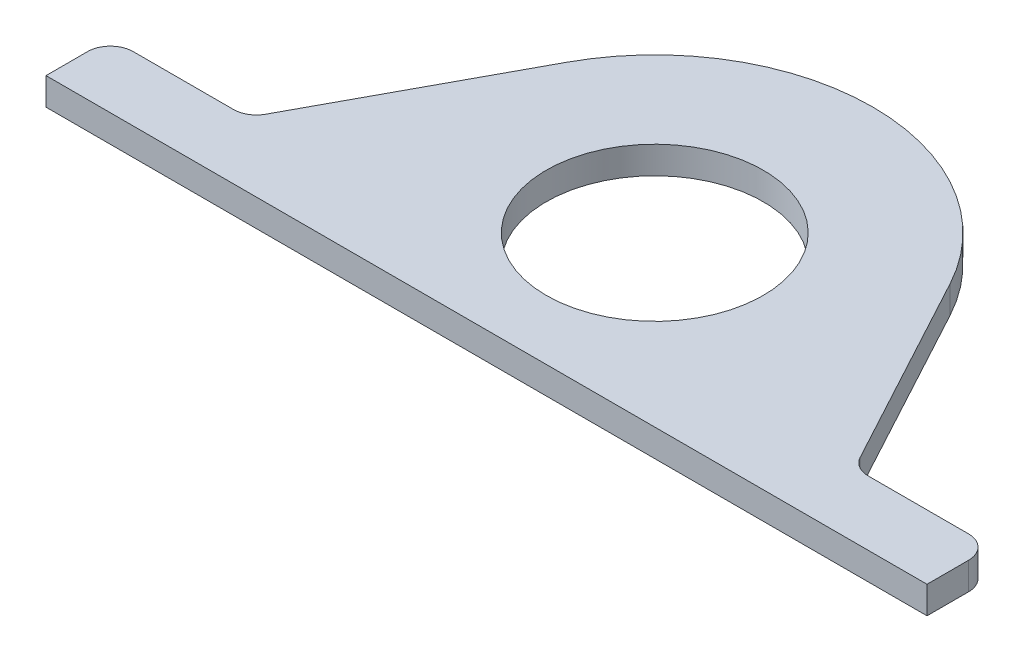
from build123d import *

# Parameters (mm, degrees)
SKETCH1_R           = 23.8
BOSS_EXTRUDE1_DEPTH = 6
SKETCH2_W           = 239.918851676
SKETCH2_H           = 8.691365156
CUT_EXTRUDE1_DEPTH  = 10


with BuildPart() as part:
    # Sketch1 → Boss-Extrude1 (new body)
    with BuildSketch(Plane(origin=(0, 0, 0), x_dir=(1, 0, 0), z_dir=(0, 1, 0))):
        with BuildLine():
            Line((65, -39.8), (-65, -39.8))
            Line((-65, -39.8), (-96.605676951, -39.8))
            Line((-96.605676951, -39.8), (-96.605676951, -27.775552827))
            ThreePointArc((-96.605676951, -27.775552827), (-95.141210857, -24.240018922), (-91.605676951, -22.775552827))
            Line((-91.605676951, -22.775552827), (-69.589095412, -22.775552827))
            ThreePointArc((-69.589095412, -22.775552827), (-67.027094411, -22.069286735), (-65.188875184, -20.150013174))
            Line((-65.188875184, -20.150013174), (-42.066105387, 22.699840916))
            ThreePointArc((-42.066105387, 22.699840916), (0, 47.8), (42.066105387, 22.699840916))
            Line((42.066105387, 22.699840916), (65.188875184, -20.150013174))
            ThreePointArc((65.188875184, -20.150013174), (67.027094411, -22.069286735), (69.589095412, -22.775552827))
            Line((69.589095412, -22.775552827), (91.605676951, -22.775552827))
            ThreePointArc((91.605676951, -22.775552827), (95.141210857, -24.240018922), (96.605676951, -27.775552827))
            Line((96.605676951, -27.775552827), (96.605676951, -39.8))
            Line((96.605676951, -39.8), (65, -39.8))
        make_face()
        with Locations(Location((0, 0, 0), (0, 0, 270))):
            Circle(SKETCH1_R, mode=Mode.SUBTRACT)
    extrude(amount=BOSS_EXTRUDE1_DEPTH)

    # Sketch2 → Cut-Extrude1 (cut)
    with BuildSketch(Plane.XZ):
        with Locations((-5.268405463, 41.245682578)):
            Rectangle(SKETCH2_W, SKETCH2_H)
    extrude(amount=-CUT_EXTRUDE1_DEPTH, mode=Mode.SUBTRACT)


solid = part.part
